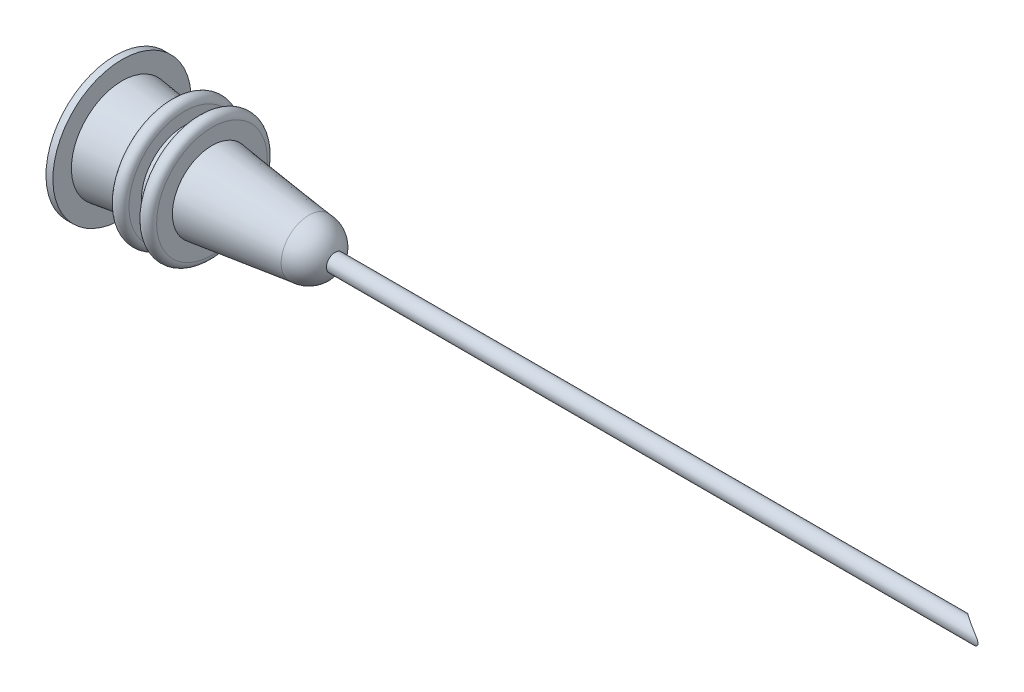
from build123d import *

# Parameters (mm, degrees)
D_ME1_FACE_RADIUS       = 2
D_ME1_HEIGHT            = 2
ESQUISSE2_R             = 0.5
ENL_V_MAT_EXTRU_1_DEPTH = 10
ESQUISSE3_R             = 0.625
ESQUISSE3_R_2           = 0.5
EXTRU_MINCE1_DEPTH      = 50
ESQUISSE4_R             = 3.5
ENL_V_MAT_EXTRU_2_DEPTH = 25
ESQUISSE5_R             = 5
ENL_V_MAT_EXTRU_3_DEPTH = 25


with BuildPart() as part:
    # Esquisse1 → Révolution1 (revolve)
    with BuildSketch(Plane.XY):
        with BuildLine():
            Line((0, 0), (-1, 0))
            Line((-1, 0), (-1, 1.3674178))
            Line((-1, 1.3674178), (-14, 2.9674178))
            Line((-14, 2.9674178), (-14, 5))
            Line((-14, 5), (-13.5, 5))
            Line((-13.5, 5), (-13.5, 3.661538462))
            Line((-13.5, 3.661538462), (-10, 3.230769231))
            Line((-10, 3.230769231), (-10, 4))
            ThreePointArc((-10, 4), (-9.5, 4.5), (-9, 4))
            Line((-9, 4), (-9, 3.107692308))
            Line((-9, 3.107692308), (-8, 2.984615385))
            Line((-8, 2.984615385), (-8, 4))
            ThreePointArc((-8, 4), (-7.5, 4.5), (-7, 4))
            Line((-7, 4), (-7, 2.861538462))
            Line((-7, 2.861538462), (0, 2))
            Line((0, 2), (0, 0))
        make_face()
    revolve(axis=Axis((18.517191928, 0, 0), (-1, 0, 0)))

    # Dôme1: a dome of height H over a round flat face of radius A is a cap of a sphere of radius (A * A + H * H) / (2 * H)
    d_me1_r = (D_ME1_FACE_RADIUS * D_ME1_FACE_RADIUS + D_ME1_HEIGHT * D_ME1_HEIGHT) / (2 * D_ME1_HEIGHT)
    d_me1_base = Plane((0, 0, 0), z_dir=(1, 0, 0))
    with Locations(d_me1_base.offset(D_ME1_HEIGHT - d_me1_r)):
        d_me1_ball = Sphere(d_me1_r, mode=Mode.PRIVATE)
    add(split(d_me1_ball, bisect_by=d_me1_base, keep=Keep.TOP, mode=Mode.PRIVATE))

    # Esquisse2 → Enlèv. mat.-Extru.1 (cut)
    with BuildSketch(Plane.ZY.offset(1)):
        with Locations(Location((0, 0, 0), (0, 0, 270))):
            Circle(ESQUISSE2_R)
    extrude(amount=-ENL_V_MAT_EXTRU_1_DEPTH, mode=Mode.SUBTRACT)

    # Esquisse3 → Extru.-Mince1 (add)
    with BuildSketch(Plane.ZY.offset(1)):
        Circle(ESQUISSE3_R)
        Circle(ESQUISSE3_R_2, mode=Mode.SUBTRACT)
    extrude(amount=-EXTRU_MINCE1_DEPTH)

    # Esquisse4 → Enlèv. mat.-Extru.2 (cut, symmetric)
    with BuildSketch(Plane(origin=(0, 0, 0), x_dir=(1, 0, 0), z_dir=(0, 1, 0))):
        with Locations((49, 3.5)):
            Circle(ESQUISSE4_R)
    extrude(amount=ENL_V_MAT_EXTRU_2_DEPTH, both=True, mode=Mode.SUBTRACT)

    # Esquisse5 → Enlèv. mat.-Extru.3 (cut, symmetric)
    with BuildSketch(Plane(origin=(0, 0, 0), x_dir=(1, 0, 0), z_dir=(0, 1, 0))):
        with Locations((50.566966107, 4.123117229)):
            Circle(ESQUISSE5_R)
    extrude(amount=ENL_V_MAT_EXTRU_3_DEPTH, both=True, mode=Mode.SUBTRACT)


solid = part.part
